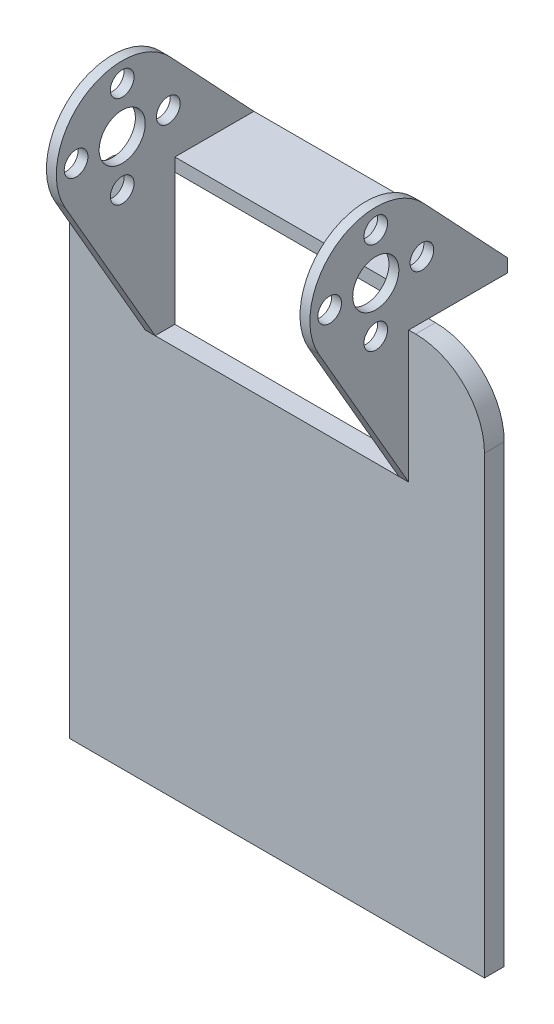
from build123d import *

# Parameters (mm, degrees)
EXTRUDE_1_DEPTH          = 3
SKETCH_13_W              = 40
SKETCH_13_H              = 2
EXTRUDE_3_DEPTH          = 15
EXTRUDE_4_DEPTH          = 20
EXTRUDE_4_DEPTH_BACK     = 20
CUT_EXTRUDE_6_DEPTH      = 18.5
CUT_EXTRUDE_6_DEPTH_BACK = 18.5
CUT_EXTRUDE_7_REACH      = 114.258
SKETCH_16_R              = 1.8
SKETCH_16_R_2            = 3.5


with BuildPart() as part:
    # 草图2 → 凸台-拉伸1 (new body)
    with BuildSketch(Plane.XY):
        with BuildLine():
            Line((0, 0), (63, 0))
            Line((63, 0), (63, 69))
            ThreePointArc((63, 69), (59.939265863, 76.389265863), (52.55, 79.45))
            Line((52.55, 79.45), (10.45, 79.45))
            ThreePointArc((10.45, 79.45), (3.060734137, 76.389265863), (0, 69))
            Line((0, 69), (0, 0))
        make_face()
    extrude(amount=EXTRUDE_1_DEPTH)

    # 草图13 → 凸台-拉伸3 (add)
    with BuildSketch(Plane(origin=(0, 0, 3), x_dir=(-1, 0, 0), z_dir=(0, 0, -1))):
        with Locations((-31.5, 80.45)):
            Rectangle(SKETCH_13_W, SKETCH_13_H)
    extrude(amount=EXTRUDE_3_DEPTH)

    # 草图14 → 凸台-拉伸4 (add, two sides: drawn at the far end of the back side and taken through both)
    with BuildSketch(Plane.ZY.offset(-31.5).offset(-EXTRUDE_4_DEPTH_BACK)):
        with BuildLine():
            ThreePointArc((3, 79.45), (10.588190451, 78.450995775), (16.660254038, 83.110254038))
            ThreePointArc((16.660254038, 83.110254038), (17.659258263, 85.522063587), (18, 88.110254038))
            ThreePointArc((18, 88.110254038), (11.686285655, 97.406021788), (0.717740386, 94.9636251))
            ThreePointArc((0.717740386, 94.9636251), (-1.999142036, 88.241244641), (0.540709407, 81.45))
            Line((0.540709407, 81.45), (3, 81.45))
            Line((3, 81.45), (3, 79.45))
        make_face()
        with BuildLine():
            ThreePointArc((0.540709407, 81.45), (1.690603791, 80.351934666), (3, 79.45))
            Line((3, 79.45), (3, 81.45))
            Line((3, 81.45), (0.540709407, 81.45))
        make_face()
        with BuildLine():
            ThreePointArc((0.540709407, 81.45), (-1.999142036, 88.241244641), (0.717740386, 94.9636251))
            Line((0.717740386, 94.9636251), (-12, 81.45))
            Line((-12, 81.45), (0.540709407, 81.45))
        make_face()
        with BuildLine():
            Line((3, 59.45), (16.660254038, 83.110254038))
            ThreePointArc((16.660254038, 83.110254038), (10.588190451, 78.450995775), (3, 79.45))
            Line((3, 79.45), (3, 59.45))
        make_face()
    extrude(amount=EXTRUDE_4_DEPTH + EXTRUDE_4_DEPTH_BACK)

    # 草图15 → 切除-拉伸6 (cut, two sides: drawn at the far end of the back side and taken through both)
    with BuildSketch(Plane.ZY.offset(-31.5).offset(-CUT_EXTRUDE_6_DEPTH_BACK)):
        with BuildLine():
            Line((0, 59.45), (3, 59.45))
            Line((3, 59.45), (16.660254038, 83.110254038))
            ThreePointArc((16.660254038, 83.110254038), (13.96660025, 96.13519525), (0.717740386, 94.9636251))
            Line((0.717740386, 94.9636251), (-12, 81.45))
            Line((-12, 81.45), (0, 81.45))
            Line((0, 81.45), (0, 59.45))
        make_face()
    extrude(amount=CUT_EXTRUDE_6_DEPTH + CUT_EXTRUDE_6_DEPTH_BACK, mode=Mode.SUBTRACT)

    # 切除-拉伸7: up to this face of the body (flat: up to its plane)
    cut_extrude_7_end = Plane(part.part.faces().sort_by_distance((51.5, 84.002247989, 5.535309017))[0])
    # 草图16 → 切除-拉伸7 (cut, up to the picked face)
    with BuildSketch(Plane.ZY.offset(-11.5), mode=Mode.PRIVATE) as cut_extrude_7_sk1:
        with Locations(Location((8, 95.110254038, 0), (0, 0, 270))):
            Circle(SKETCH_16_R)
    cut_extrude_7_tool1 = split(extrude(cut_extrude_7_sk1.sketch, amount=-CUT_EXTRUDE_7_REACH, mode=Mode.PRIVATE), bisect_by=cut_extrude_7_end, keep=Keep.BOTH, mode=Mode.PRIVATE)
    # 草图16 → 切除-拉伸7 (cut, up to the picked face)
    with BuildSketch(Plane.ZY.offset(-11.5), mode=Mode.PRIVATE) as cut_extrude_7_sk2:
        with Locations(Location((15, 88.110254038, 0), (0, 0, 270))):
            Circle(SKETCH_16_R)
    cut_extrude_7_tool2 = split(extrude(cut_extrude_7_sk2.sketch, amount=-CUT_EXTRUDE_7_REACH, mode=Mode.PRIVATE), bisect_by=cut_extrude_7_end, keep=Keep.BOTH, mode=Mode.PRIVATE)
    # 草图16 → 切除-拉伸7 (cut, up to the picked face)
    with BuildSketch(Plane.ZY.offset(-11.5), mode=Mode.PRIVATE) as cut_extrude_7_sk3:
        with Locations(Location((8, 81.110254038, 0), (0, 0, 270))):
            Circle(SKETCH_16_R)
    cut_extrude_7_tool3 = split(extrude(cut_extrude_7_sk3.sketch, amount=-CUT_EXTRUDE_7_REACH, mode=Mode.PRIVATE), bisect_by=cut_extrude_7_end, keep=Keep.BOTH, mode=Mode.PRIVATE)
    # 草图16 → 切除-拉伸7 (cut, up to the picked face)
    with BuildSketch(Plane.ZY.offset(-11.5), mode=Mode.PRIVATE) as cut_extrude_7_sk4:
        with Locations(Location((1, 88.110254038, 0), (0, 0, 270))):
            Circle(SKETCH_16_R)
    cut_extrude_7_tool4 = split(extrude(cut_extrude_7_sk4.sketch, amount=-CUT_EXTRUDE_7_REACH, mode=Mode.PRIVATE), bisect_by=cut_extrude_7_end, keep=Keep.BOTH, mode=Mode.PRIVATE)
    # 草图16 → 切除-拉伸7 (cut, up to the picked face)
    with BuildSketch(Plane.ZY.offset(-11.5), mode=Mode.PRIVATE) as cut_extrude_7_sk5:
        with Locations(Location((8, 88.110254038, 0), (0, 0, 270))):
            Circle(SKETCH_16_R_2)
    cut_extrude_7_tool5 = split(extrude(cut_extrude_7_sk5.sketch, amount=-CUT_EXTRUDE_7_REACH, mode=Mode.PRIVATE), bisect_by=cut_extrude_7_end, keep=Keep.BOTH, mode=Mode.PRIVATE)
    add(cut_extrude_7_tool1.solids().sort_by(Axis((11.5, 95.110254, 8), (1, 0, 0)))[0], mode=Mode.SUBTRACT)
    add(cut_extrude_7_tool2.solids().sort_by(Axis((11.5, 88.110254, 15), (1, 0, 0)))[0], mode=Mode.SUBTRACT)
    add(cut_extrude_7_tool3.solids().sort_by(Axis((11.5, 81.110254, 8), (1, 0, 0)))[0], mode=Mode.SUBTRACT)
    add(cut_extrude_7_tool4.solids().sort_by(Axis((11.5, 88.110254, 1), (1, 0, 0)))[0], mode=Mode.SUBTRACT)
    add(cut_extrude_7_tool5.solids().sort_by(Axis((11.5, 88.110254, 8), (1, 0, 0)))[0], mode=Mode.SUBTRACT)


solid = part.part
